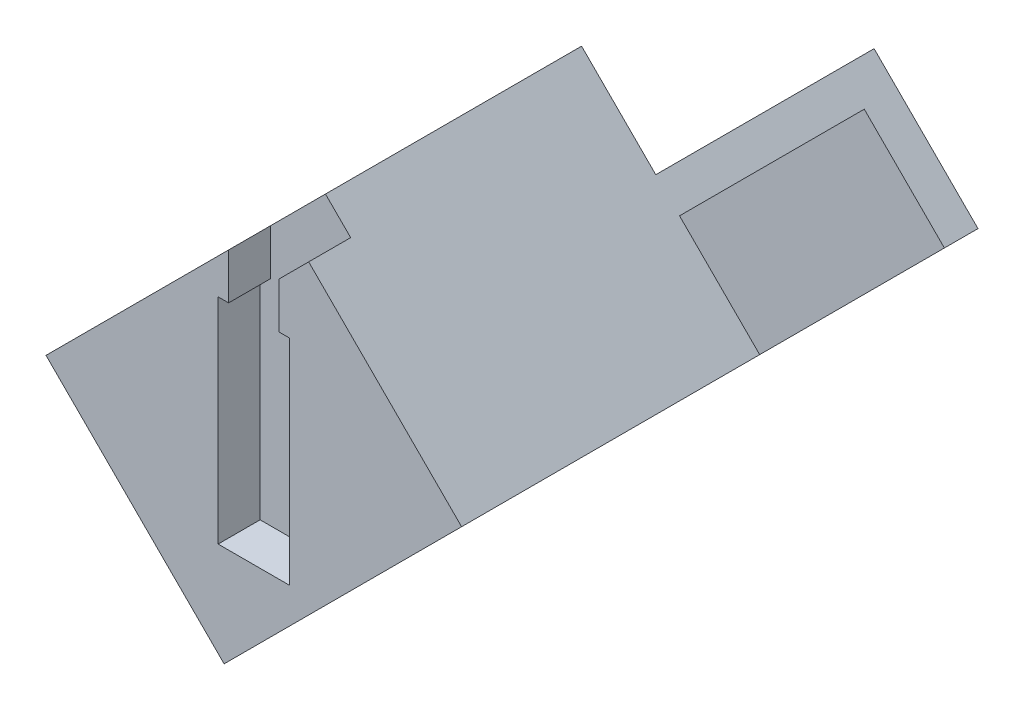
from build123d import *

# Parameters (mm, degrees)
SKETCH_1_W          = 8.5
SKETCH_1_H          = 25.5
EXTRUDE_1_DEPTH     = 5
EXTRUDE_2_DEPTH     = 5
SKETCH_3_W          = 8.5
SKETCH_3_H          = 25.5
EXTRUDE_3_DEPTH     = 5
EXTRUDE_4_DEPTH     = 25.5
EXTRUDE_5_DEPTH     = 35.5
CUT_EXTRUDE_1_DEPTH = 5
CUT_EXTRUDE_2_DEPTH = 25.5
EXTRUDE_6_REACH     = 63.804
SKETCH_8_W          = 22
SKETCH_8_H          = 4
EXTRUDE_7_DEPTH     = 4
SKETCH_10_W         = 26
SKETCH_10_H         = 34
CUT_EXTRUDE_3_DEPTH = 4


with BuildPart() as part:
    # 草图1 → 凸台-拉伸1 (new body)
    with BuildSketch(Plane.XY):
        Polygon((-16.963203436, -12.75), (4.25, -33.963203436), (25.463203436, -12.75), (4.25, 8.463203436), align=None)
        with Locations((4.25, -12.75)):
            Rectangle(SKETCH_1_W, SKETCH_1_H, mode=Mode.SUBTRACT)
    extrude(amount=EXTRUDE_1_DEPTH)

    # 草图2 → 凸台-拉伸2 (add)
    with BuildSketch(Plane.XY.offset(5)):
        Polygon((1.25, 0), (1.25, 5.463203436), (-16.963203436, -12.75), (4.25, -33.963203436), (25.463203436, -12.75), (7.25, 5.463203436), (7.25, 0), (8.5, 0), (8.5, -25.5), (0, -25.5), (0, 0), align=None)
    extrude(amount=EXTRUDE_2_DEPTH)

    # 草图3 → 凸台-拉伸3 (add)
    with BuildSketch(Plane.XY.offset(5)):
        with Locations((4.25, -12.75)):
            Rectangle(SKETCH_3_W, SKETCH_3_H)
    extrude(amount=-EXTRUDE_3_DEPTH)

    # 草图4 → 凸台-拉伸4 (add)
    with BuildSketch(Plane(origin=(0, 0, 0), x_dir=(-1, 0, 0), z_dir=(0, 0, -1))):
        Polygon((-25.463203436, -12.75), (-4.25, -33.963203436), (16.963203436, -12.75), (-4.25, 8.463203436), align=None)
        Polygon((12.720562748, -12.75), (-4.25, 4.220562748), (-21.220562748, -12.75), (-4.25, -29.720562748), align=None, mode=Mode.SUBTRACT)
    extrude(amount=EXTRUDE_4_DEPTH)

    # 草图5 → 凸台-拉伸5 (add)
    with BuildSketch(Plane.XY.offset(10)):
        Polygon((4.25, 8.463203436), (25.463203436, -12.75), (28.998737342, -9.214466094), (7.785533906, 11.998737342), align=None)
        Polygon((-16.963203436, -12.75), (-20.498737342, -16.285533906), (0.714466094, -37.498737342), (4.25, -33.963203436), align=None)
    extrude(amount=-EXTRUDE_5_DEPTH)

    # 草图6 → 切除-拉伸1 (cut)
    with BuildSketch(Plane.XY.offset(10)):
        Polygon((7.25, 5.463203436), (10.785533906, 8.998737342), (7.785533906, 11.998737342), (4.25, 8.463203436), align=None)
    extrude(amount=-CUT_EXTRUDE_1_DEPTH, mode=Mode.SUBTRACT)

    # 草图7 → 切除-拉伸2 (cut)
    with BuildSketch(Plane(origin=(0, 0, -25.5), x_dir=(-1, 0, 0), z_dir=(0, 0, -1))):
        Polygon((-4.25, 4.220562748), (-7.785533906, 7.756096654), (-24.756096654, -9.214466094), (-21.220562748, -12.75), align=None)
        Polygon((12.720562748, -12.75), (16.256096654, -16.285533906), (-0.714466094, -33.256096654), (-4.25, -29.720562748), align=None)
    extrude(amount=-CUT_EXTRUDE_2_DEPTH, mode=Mode.SUBTRACT)

    # 凸台-拉伸6: up to this face of the body (flat: up to its plane)
    extrude_6_end = Plane(part.part.faces().sort_by_distance((-9.892135624, -26.892135624, -7.75))[0])
    # 草图8 → 凸台-拉伸6 (add, up to the picked face)
    with BuildSketch(Plane(origin=(9.892135624, 9.892135624, 0), x_dir=(0, 0, -1), z_dir=(0.7071067811865537, 0.7071067811865415, 0)), mode=Mode.PRIVATE) as extrude_6_sk1:
        with Locations((36.5, -11.52081528)):
            Rectangle(SKETCH_8_W, SKETCH_8_H)
    extrude_6_tool1 = split(extrude(extrude_6_sk1.sketch, amount=-EXTRUDE_6_REACH, mode=Mode.PRIVATE), bisect_by=extrude_6_end, keep=Keep.BOTH, mode=Mode.PRIVATE)
    add(extrude_6_tool1.solids().sort_by(Axis((18.038582, 1.745689, -36.5), (-0.7071067811865537, -0.7071067811865415, 0)))[0])

    # 草图9 → 凸台-拉伸7 (add)
    with BuildSketch(Plane(origin=(0, 0, -47.5), x_dir=(-1, 0, 0), z_dir=(0, 0, -1))):
        Polygon((-16.624368671, 3.159902577), (-28.998737342, -9.214466094), (-0.714466094, -37.498737342), (11.659902577, -25.124368671), align=None)
    extrude(amount=EXTRUDE_7_DEPTH)

    # 草图10 → 切除-拉伸3 (cut)
    with BuildSketch(Plane(origin=(9.560660172, -9.560660172, 0), x_dir=(0, 0, -1), z_dir=(0.7071067811865416, -0.7071067811865536, 0))):
        with Locations((38.5, -6.01040764)):
            Rectangle(SKETCH_10_W, SKETCH_10_H)
    extrude(amount=-CUT_EXTRUDE_3_DEPTH, mode=Mode.SUBTRACT)


solid = part.part
